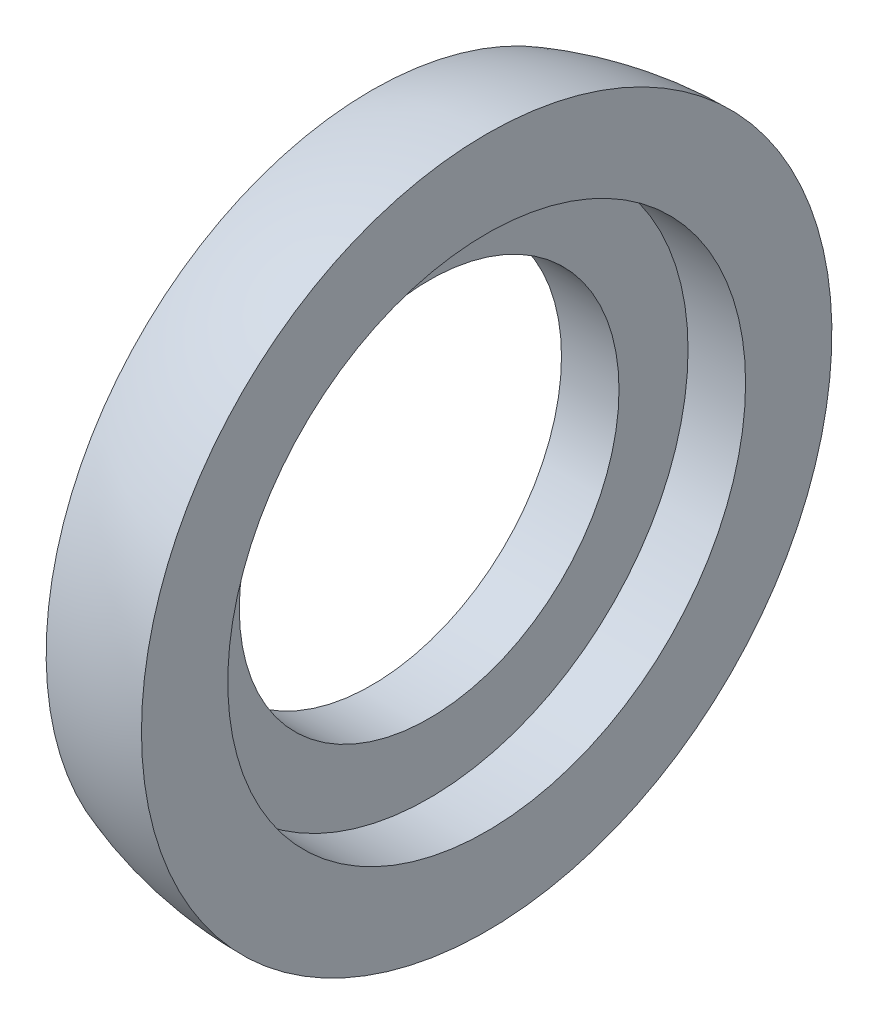
from build123d import *

# Parameters (mm, degrees)
REVOLVE_1_ANGLE          = 180
CUT_EXTRUDE_3_DEPTH      = 21.784609691
CUT_EXTRUDE_3_DEPTH_BACK = 21.784609691
SKETCH_5_W               = 8
SKETCH_5_H               = 30
SKETCH_11_R              = 6.6
CUT_EXTRUDE_7_DEPTH      = 18.435595774
SKETCH_12_R              = 9
CUT_EXTRUDE_8_DEPTH      = 2


with BuildPart() as part:
    # 草图1 → 旋转1 (revolve)
    with BuildSketch(Plane(origin=(0, 0, 0), x_dir=(0, 0, -1), z_dir=(1, 0, 0))):
        with BuildLine():
            Line((0, 12), (0, -12))
            ThreePointArc((0, -12), (-12, 0), (0, 12))
        make_face()
    revolve(axis=Axis((0, 12, 0), (0, -1, 0)), revolution_arc=REVOLVE_1_ANGLE)

    # 草图5 → 切除-拉伸3 (cut, two sides: drawn at the far end of the back side and taken through both)
    with BuildSketch(Plane.XY.offset(-CUT_EXTRUDE_3_DEPTH_BACK)):
        with Locations((-8, 0.775192037)):
            Rectangle(SKETCH_5_W, SKETCH_5_H)
    extrude(amount=CUT_EXTRUDE_3_DEPTH + CUT_EXTRUDE_3_DEPTH_BACK, mode=Mode.SUBTRACT)


with BuildPart() as cut_extrude_3_kept_piece:
    # of the separate pieces the step leaves, the one the design keeps (cut_extrude_3_pieces_kept)
    add(part.part.solids().sort_by_distance((0, -12, 0))[0])

    # 草图11 → 切除-拉伸7 (cut, through all)
    with BuildSketch(Plane(origin=(0, 0, 0), x_dir=(0, 0, -1), z_dir=(1, 0, 0))):
        Circle(SKETCH_11_R)
    extrude(amount=-CUT_EXTRUDE_7_DEPTH, mode=Mode.SUBTRACT)

    # 草图12 → 切除-拉伸8 (cut)
    with BuildSketch(Plane(origin=(0, 0, 0), x_dir=(0, 0, -1), z_dir=(1, 0, 0))):
        Circle(SKETCH_12_R)
    extrude(amount=-CUT_EXTRUDE_8_DEPTH, mode=Mode.SUBTRACT)


solid = cut_extrude_3_kept_piece.part
